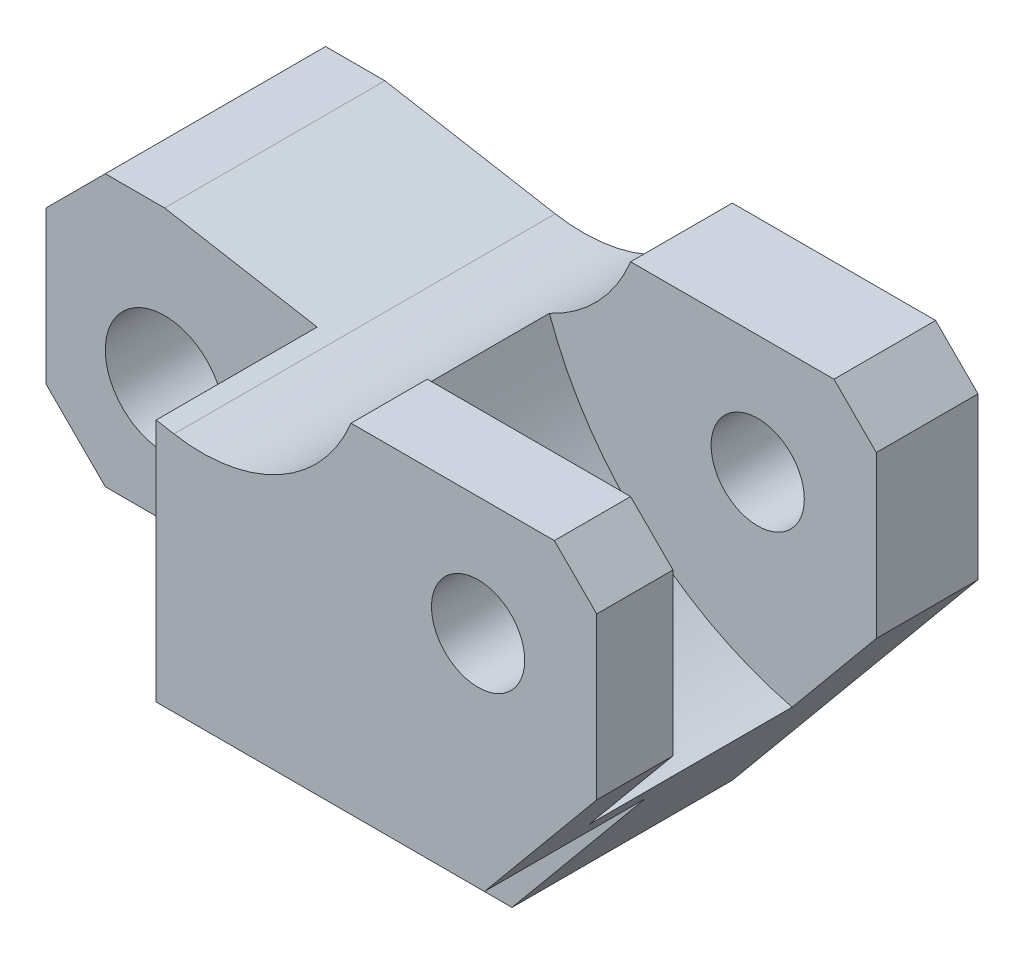
from build123d import *

# Parameters (mm, degrees)
BOSS_EXTRU_1_DEPTH      = 22.5
ESQUISSE2_R             = 7
ENL_V_MAT_EXTRU_1_DEPTH = 89.82992258
ENL_V_MAT_EXTRU_2_DEPTH = 19
ENL_V_START             = -9
ENL_V_MAT_EXTRU_3_DEPTH = 24
ESQUISSE6_R             = 5.5
ENL_V_MAT_EXTRU_4_DEPTH = 89.82992258


with BuildPart() as part:
    # Esquisse1 → Boss.-Extru.1 (new, symmetric)
    with BuildSketch(Plane.XY):
        with BuildLine():
            Line((0, 0), (6.166045157, 0))
            Line((6.166045157, 0), (35.166045157, 35))
            Line((35.166045157, 35), (35.166045157, 54))
            Line((35.166045157, 54), (30.166045157, 59))
            Line((30.166045157, 59), (6.166045157, 59))
            ThreePointArc((6.166045157, 59), (-2.242317514, 49.535902458), (-14.729912491, 47.455114912))
            Line((-14.729912491, 47.455114912), (-34.833954843, 51))
            Line((-34.833954843, 51), (-41.833954843, 51))
            Line((-41.833954843, 51), (-48.833954843, 44))
            Line((-48.833954843, 44), (-48.833954843, 26))
            Line((-48.833954843, 26), (-41.833954843, 19))
            Line((-41.833954843, 19), (-11.721441141, 19))
            ThreePointArc((-11.721441141, 19), (-8.45620536, 17.786586232), (-6.7758024, 14.735294118))
            ThreePointArc((-6.7758024, 14.735294118), (-4.438972197, 6.884327939), (0, 0))
        make_face()
    extrude(amount=BOSS_EXTRU_1_DEPTH, both=True)

    # Esquisse2 → Enlèv. mat.-Extru.1 (cut, through all)
    with BuildSketch(Plane.XY.offset(22.5)):
        with Locations((-34.833954843, 33)):
            Circle(ESQUISSE2_R)
    extrude(amount=-ENL_V_MAT_EXTRU_1_DEPTH, mode=Mode.SUBTRACT)

    # Esquisse4 → Enlèv. mat.-Extru.2 (cut)
    with BuildSketch(Plane.XY.offset(22.5)):
        Polygon((-16.833954843, 47.826114347), (-16.833954843, 19), (-41.833954843, 19), (-48.833954843, 26), (-48.833954843, 44), (-41.833954843, 51), (-34.833954843, 51), align=None)
        with BuildLine():
            Line((-11.721441141, 19), (21.9089023, 19))
            Line((21.9089023, 19), (6.166045157, 0))
            Line((6.166045157, 0), (0, 0))
            ThreePointArc((0, 0), (-4.438972197, 6.884327939), (-6.7758024, 14.735294118))
            ThreePointArc((-6.7758024, 14.735294118), (-8.45620536, 17.786586232), (-11.721441141, 19))
        make_face()
    extrude(amount=-ENL_V_MAT_EXTRU_2_DEPTH, mode=Mode.SUBTRACT)

    # Esquisse5 → Enlèv. mat.-Extru.3 (cut)
    with BuildSketch(Plane.XY.offset(22.5).offset(ENL_V_START)):
        with BuildLine():
            Line((25.223188014, 23), (35.166045157, 35))
            Line((35.166045157, 35), (35.166045157, 54))
            Line((35.166045157, 54), (30.166045157, 59))
            Line((30.166045157, 59), (6.166045157, 59))
            ThreePointArc((6.166045157, 59), (2.323444718, 53.058207825), (-3.426832653, 48.93452227))
            ThreePointArc((-3.426832653, 48.93452227), (7.650971958, 32.380053701), (25.223188014, 23))
        make_face()
    extrude(amount=-ENL_V_MAT_EXTRU_3_DEPTH, mode=Mode.SUBTRACT)

    # Esquisse6 → Enlèv. mat.-Extru.4 (cut, through all)
    with BuildSketch(Plane.XY.offset(22.5)):
        with Locations((21.166045157, 45)):
            Circle(ESQUISSE6_R)
    extrude(amount=-ENL_V_MAT_EXTRU_4_DEPTH, mode=Mode.SUBTRACT)


solid = part.part
